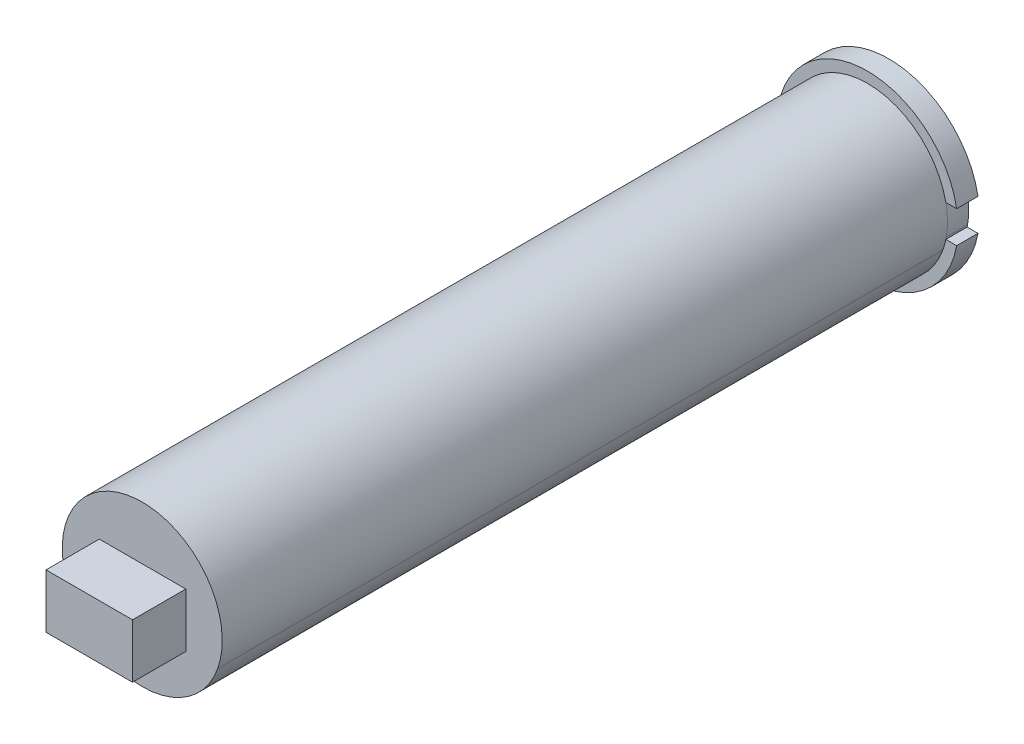
from build123d import *

# Parameters (mm, degrees)
BOSS_EXTRUDE1_DEPTH = 70
SKETCH3_OUTSIDE_W   = 33.524
SKETCH3_OUTSIDE_H   = 33.79
CUT_EXTRUDE1_DEPTH  = 68
SKETCH4_R           = 7.49997237
BOSS_EXTRUDE2_DEPTH = 68
SKETCH5_W           = 8.11107671
SKETCH5_H           = 5.069422944
BOSS_EXTRUDE3_DEPTH = 5


with BuildPart() as part:
    # Sketch1 → Boss-Extrude1 (new body)
    with BuildSketch(Plane.XY):
        with BuildLine():
            Line((8.366577148, 1.499996008), (7.348449707, 1.499996008))
            ThreePointArc((7.348449707, 1.499996008), (7.499325165, 0.100591557), (7.386047363, -1.302356897))
            Line((7.386047363, -1.302356897), (7.348449707, -1.500003992))
            Line((7.348449707, -1.500003992), (8.366577148, -1.500003992))
            ThreePointArc((8.366577148, -1.500003992), (0, -8.499996008), (-8.366577148, -1.500003992))
            Line((-8.366577148, -1.500003992), (-7.348449707, -1.500003992))
            ThreePointArc((-7.348449707, -1.500003992), (-7.5, -3.992e-06), (-7.348449707, 1.499996008))
            Line((-7.348449707, 1.499996008), (-8.366577148, 1.499996008))
            ThreePointArc((-8.366577148, 1.499996008), (0, 8.499996008), (8.366577148, 1.499996008))
        make_face()
    extrude(amount=BOSS_EXTRUDE1_DEPTH)

    # Sketch3 outside → Cut-Extrude1 (cut)
    with BuildSketch(Plane.XY.offset(70)):
        Rectangle(SKETCH3_OUTSIDE_W, SKETCH3_OUTSIDE_H)
        with BuildLine():
            Line((7.071046662, -2.500003992), (6.140291283, -2.500003992))
            Line((6.140291283, -2.500003992), (6.402364031, -1.122313933))
            ThreePointArc((6.402364031, -1.122313933), (6.46025724, 0.717628617), (5.999924003, 2.499996008))
            Line((5.999924003, 2.499996008), (7.071048275, 2.499996008))
            ThreePointArc((7.071048275, 2.499996008), (0, 7.499996008), (-7.071048275, 2.499996008))
            Line((-7.071048275, 2.499996008), (-5.999921107, 2.499996008))
            ThreePointArc((-5.999921107, 2.499996008), (-6.5, -3.992e-06), (-5.999921107, -2.500003992))
            Line((-5.999921107, -2.500003992), (-7.071046662, -2.500003992))
            ThreePointArc((-7.071046662, -2.500003992), (0, -7.499996008), (7.071046662, -2.500003992))
        make_face(mode=Mode.SUBTRACT)
    extrude(amount=-CUT_EXTRUDE1_DEPTH, mode=Mode.SUBTRACT)

    # Sketch4 → Boss-Extrude2 (add)
    with BuildSketch(Plane.XY.offset(70)):
        with Locations((0, 2.3638e-05)):
            Circle(SKETCH4_R)
    extrude(amount=-BOSS_EXTRUDE2_DEPTH)

    # Sketch5 → Boss-Extrude3 (add)
    with BuildSketch(Plane.XY.offset(70)):
        with Locations((0.02948665, -0.0589733)):
            Rectangle(SKETCH5_W, SKETCH5_H)
    extrude(amount=BOSS_EXTRUDE3_DEPTH)


solid = part.part
